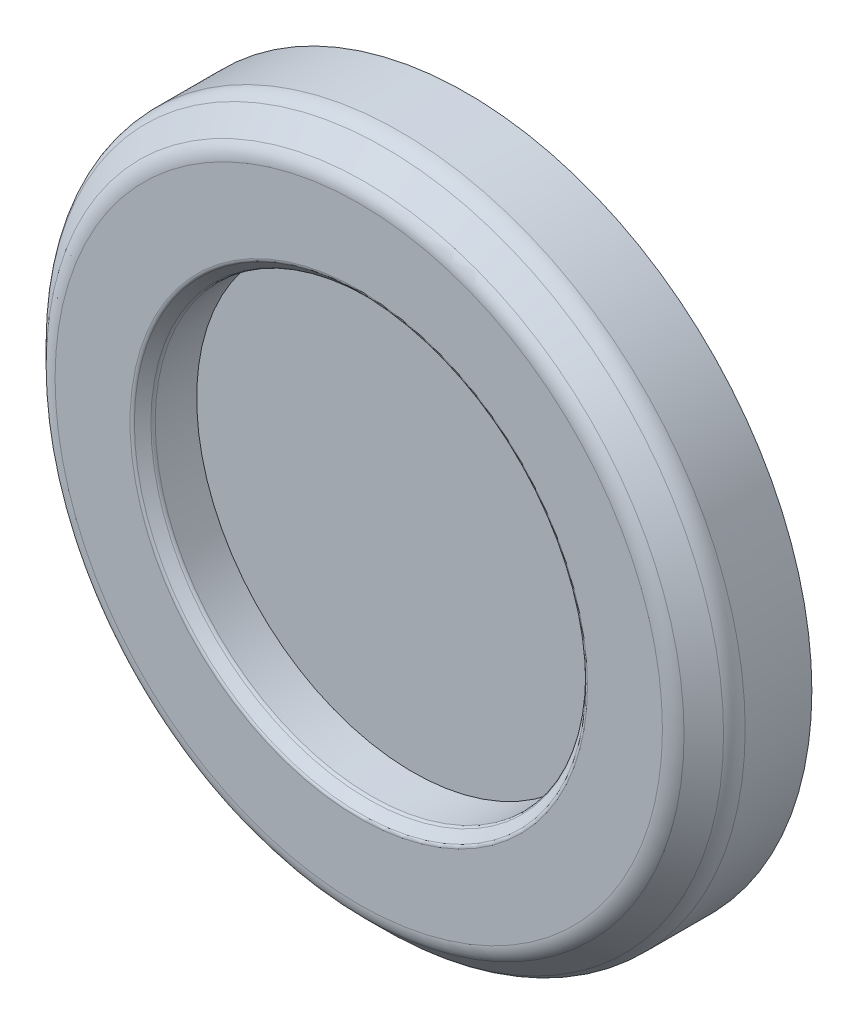
from build123d import *

# Parameters (mm, degrees)
SKETCH1_R           = 31.93
BOSS_EXTRUDE1_DEPTH = 10
CHAMFER1_SIZE       = 3
FILLET1_R           = 2
SKETCH2_R           = 20
CUT_EXTRUDE1_DEPTH  = 5
CHAMFER2_SIZE       = 1
FILLET2_R           = 0.4


with BuildPart() as part:
    # Sketch1 → Boss-Extrude1 (new body)
    with BuildSketch(Plane.XY):
        Circle(SKETCH1_R)
    extrude(amount=BOSS_EXTRUDE1_DEPTH)

    # Chamfer1
    chamfer1_edges = [part.edges().sort_by_distance(p)[0] for p in [
        (-31.93, 0, 10),
    ]]
    chamfer(chamfer1_edges, length=CHAMFER1_SIZE)

    # Fillet1
    fillet1_edges = [part.edges().sort_by_distance(p)[0] for p in [
        (-28.93, 0, 10),
        (-31.93, 0, 7),
    ]]
    fillet(fillet1_edges, radius=FILLET1_R)

    # Sketch2 → Cut-Extrude1 (cut)
    with BuildSketch(Plane.XY.offset(10)):
        Circle(SKETCH2_R)
    extrude(amount=-CUT_EXTRUDE1_DEPTH, mode=Mode.SUBTRACT)

    # Chamfer2
    chamfer2_edges = [part.edges().sort_by_distance(p)[0] for p in [
        (-20, 0, 10),
    ]]
    chamfer(chamfer2_edges, length=CHAMFER2_SIZE)

    # Fillet2
    fillet2_edges = [part.edges().sort_by_distance(p)[0] for p in [
        (-20, 0, 9),
        (-21, 0, 10),
    ]]
    fillet(fillet2_edges, radius=FILLET2_R)


solid = part.part
